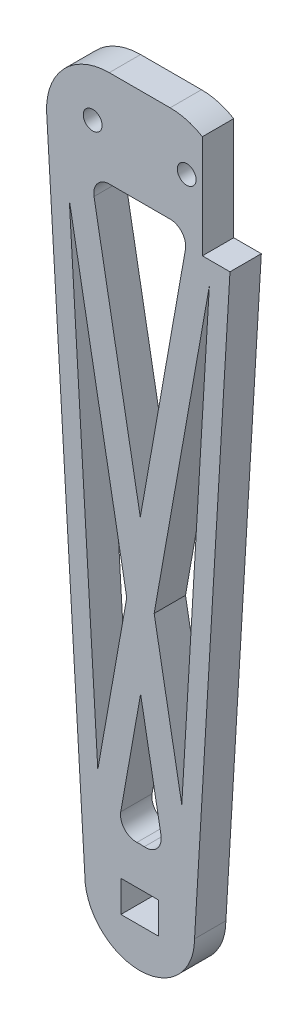
from build123d import *

# Parameters (mm, degrees)
SKETCH1_R           = 3
BOSS_EXTRUDE2_DEPTH = 10
FILLET1_R           = 20
FILLET2_R           = 20
CUT_EXTRUDE1_START  = -10
CUT_EXTRUDE1_DEPTH  = 10
FILLET3_R           = 5
CUT_EXTRUDE6_DEPTH  = 10


with BuildPart() as part:
    # Sketch1 → Boss-Extrude2 (new body)
    with BuildSketch(Plane.XY):
        with BuildLine():
            Line((-30, 15.770412854), (-30, 0))
            Line((-30, 0), (-17.5, -210))
            ThreePointArc((-17.5, -210), (0, -227.5), (17.5, -210))
            Line((17.5, -210), (30, 0))
            Line((30, 0), (30, 15.770412854))
            Line((30, 15.770412854), (-30, 15.770412854))
        make_face()
        with Locations((-15, 0)):
            Circle(SKETCH1_R, mode=Mode.SUBTRACT)
        with Locations((15, 0)):
            Circle(SKETCH1_R, mode=Mode.SUBTRACT)
        Polygon((0, -205), (6, -205), (6, -215), (-6, -215), (-6, -205), align=None, mode=Mode.SUBTRACT)
    extrude(amount=BOSS_EXTRUDE2_DEPTH)

    # Fillet1
    fillet1_edges = [part.edges().sort_by_distance(p)[0] for p in [
        (-30, 15.770412854, 5),
    ]]
    fillet(fillet1_edges, radius=FILLET1_R)

    # Fillet2
    fillet2_edges = [part.edges().sort_by_distance(p)[0] for p in [
        (30, 15.770412854, 5),
    ]]
    fillet(fillet2_edges, radius=FILLET2_R)

    # Sketch4 → Cut-Extrude1 (cut)
    with BuildSketch(Plane.XY.offset(10).offset(CUT_EXTRUDE1_START)):
        Polygon((-15.651797422, -15), (0.190220551, -102.160979768), (15.643622882, -15), (15, -15), align=None)
        Polygon((-22.473027071, -25.6531452), (-13.367328465, -178.628881795), (-4.134156204, -126.551525408), align=None)
        Polygon((22.230419841, -27.161313899), (4.615986353, -126.511039477), (13.430162671, -175.005634359), align=None)
        with BuildLine():
            Line((0.291609598, -150.901585116), (-7.372445375, -194.128735111))
            ThreePointArc((-7.372445375, -194.128735111), (0.476576628, -192.506490497), (8.225632191, -194.553674383))
            Line((8.225632191, -194.553674383), (0.291609598, -150.901585116))
        make_face()
    extrude(amount=CUT_EXTRUDE1_DEPTH, mode=Mode.SUBTRACT)

    # Fillet3
    fillet3_edges = [part.edges().sort_by_distance(p)[0] for p in [
        (8.225632191, -194.553674383, 5),
        (-7.372445375, -194.128735111, 5),
        (-15.651797422, -15, 5),
        (15.643622882, -15, 5),
    ]]
    fillet(fillet3_edges, radius=FILLET3_R)

    # Sketch5 → Cut-Extrude6 (cut)
    with BuildSketch(Plane.XY.offset(10)):
        with BuildLine():
            Line((29.260488635, 0), (20, 0))
            Line((20, 0), (20, -20))
            Line((20, -20), (28.80952381, -20))
            Line((28.80952381, -20), (29.677502384, -5.417959945))
            ThreePointArc((29.677502384, -5.417959945), (29.653859351, -2.694751229), (29.260488635, 0))
        make_face()
        with BuildLine():
            Line((20, 12.921923742), (20, 0))
            Line((20, 0), (29.260488635, 0))
            ThreePointArc((29.260488635, 0), (25.96931496, 7.420606017), (20, 12.921923742))
        make_face()
    extrude(amount=-CUT_EXTRUDE6_DEPTH, mode=Mode.SUBTRACT)


solid = part.part
